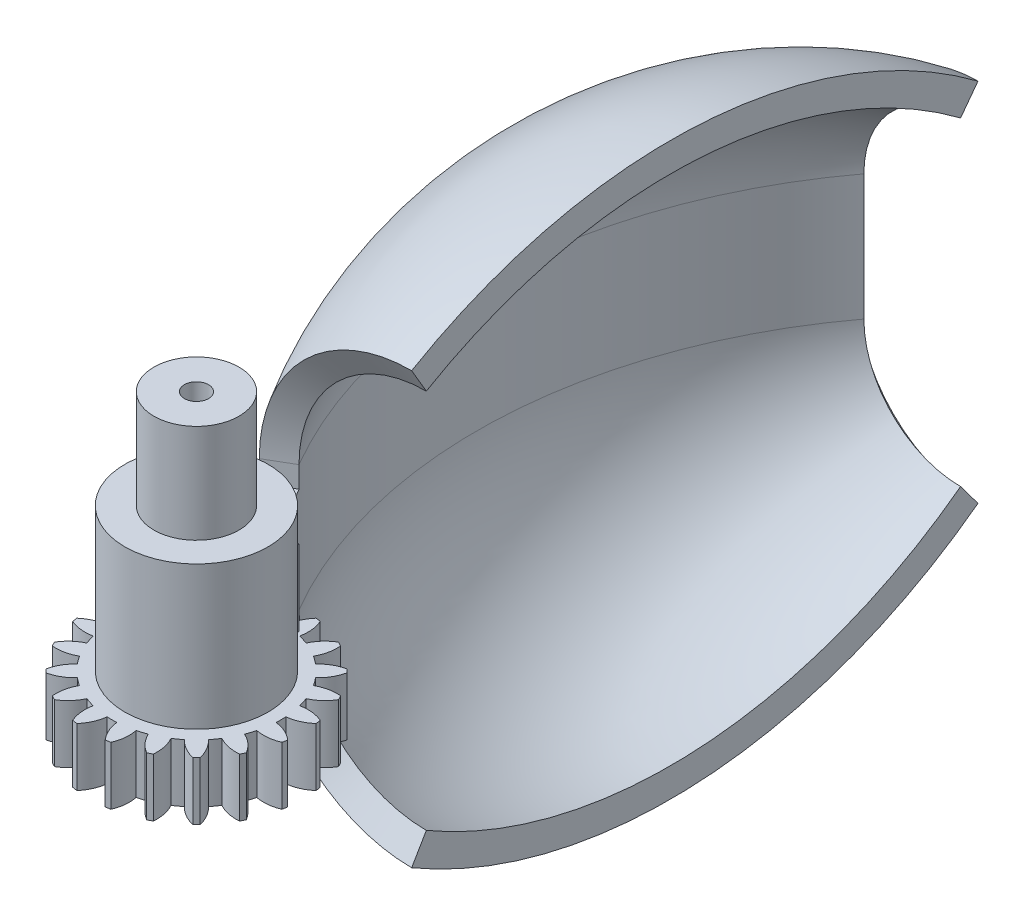
from build123d import *

# Parameters (mm, degrees)
SKETCH_1_R          = 1.25
EXTRUDE_2_DEPTH     = 3
EXTRUDE_6_DEPTH     = 10
REVOLVE_5_ANGLE     = 90
SKETCH_5_R          = 7.4
SKETCH_5_R_2        = 1.25
EXTRUDE_3_DEPTH     = 14.8
SKETCH_6_R          = 4.4
SKETCH_6_R_2        = 1.25
EXTRUDE_4_DEPTH     = 10.2
REVOLVE_6_ANGLE     = 90
EXTRUDE_7_DEPTH     = 7.8
CUT_EXTRUDE_1_DEPTH = 3
EXTRUDE_START       = 3
EXTRUDE_9_DEPTH     = 3
EXTRUDE_10_DEPTH    = 3


with BuildPart() as part:
    # 草图1 → 凸台-拉伸2 (new body)
    with BuildSketch(Plane(origin=(0, 0, 0), x_dir=(1, 0, 0), z_dir=(0, 1, 0))):
        with BuildLine():
            Line((-2.4, 31.8), (0, 30))
            ThreePointArc((0, 30), (-9.986161593, 1.176286204), (-1.366875999, -28.085255385))
            ThreePointArc((-1.366875999, -28.085255385), (0.001505949, -29.44044019), (1.780593172, -30.177897759))
            ThreePointArc((1.780593172, -30.177897759), (2.675299798, -47.593181657), (-6.473683781, -32.747686964))
            ThreePointArc((-6.473683781, -32.747686964), (-5.105814689, -29.870106713), (-5.753780394, -26.750543539))
            ThreePointArc((-5.753780394, -26.750543539), (-12.913266641, 3.030876667), (-2.4, 31.8))
        make_face()
        with Locations(Location((0, -39, 0), (0, 0, 270))):
            Circle(SKETCH_1_R, mode=Mode.SUBTRACT)
    extrude(amount=EXTRUDE_2_DEPTH)

    # 草图2 → 凸台-拉伸6 (add)
    with BuildSketch(Plane(origin=(0, 3, 0), x_dir=(1, 0, 0), z_dir=(0, 1, 0))):
        with BuildLine():
            Line((-5.753780394, -26.750543539), (-3.163943768, -25.236361829))
            ThreePointArc((-3.163943768, -25.236361829), (-9.918176076, 2.85931761), (0, 30))
            Line((0, 30), (-2.4, 31.8))
            ThreePointArc((-2.4, 31.8), (-12.913266641, 3.030876667), (-5.753780394, -26.750543539))
        make_face()
    extrude(amount=EXTRUDE_6_DEPTH)

    # 草图3 → 旋转5 (revolve)
    with BuildSketch(Plane.XZ):
        with BuildLine():
            Line((0, -30), (-2.4, -31.8))
            ThreePointArc((-2.4, -31.8), (-12.913266641, -3.030876667), (-5.753780394, 26.750543539))
            Line((-5.753780394, 26.750543539), (-3.163943768, 25.236361829))
            ThreePointArc((-3.163943768, 25.236361829), (-9.918176076, -2.85931761), (0, -30))
        make_face()
    revolve(axis=Axis((10, 0, 8.965056224), (0, 0, 1)), revolution_arc=REVOLVE_5_ANGLE)

    # 草图5 → 凸台-拉伸3 (add)
    with BuildSketch(Plane(origin=(0, 3, 0), x_dir=(1, 0, 0), z_dir=(0, 1, 0))):
        with Locations(Location((0, -39, 0), (0, 0, 270))):
            Circle(SKETCH_5_R)
        with Locations(Location((0, -39, 0), (0, 0, 270))):
            Circle(SKETCH_5_R_2, mode=Mode.SUBTRACT)
    extrude(amount=EXTRUDE_3_DEPTH)

    # 草图6 → 凸台-拉伸4 (add)
    with BuildSketch(Plane(origin=(0, 17.8, 0), x_dir=(1, 0, 0), z_dir=(0, 1, 0))):
        with Locations(Location((0, -39, 0), (0, 0, 270))):
            Circle(SKETCH_6_R)
        with Locations(Location((0, -39, 0), (0, 0, 270))):
            Circle(SKETCH_6_R_2, mode=Mode.SUBTRACT)
    extrude(amount=EXTRUDE_4_DEPTH)

    # 草图8 → 旋转6 (revolve)
    with BuildSketch(Plane(origin=(0, 13, 0), x_dir=(1, 0, 0), z_dir=(0, 1, 0))):
        with BuildLine():
            Line((0, 30), (-2.4, 31.8))
            ThreePointArc((-2.4, 31.8), (-12.913266641, 3.030876667), (-5.753780394, -26.750543539))
            Line((-5.753780394, -26.750543539), (-3.163943768, -25.236361829))
            ThreePointArc((-3.163943768, -25.236361829), (-9.918176076, 2.85931761), (0, 30))
        make_face()
    revolve(axis=Axis((10, 13, 0), (0, 0, -1)), revolution_arc=REVOLVE_6_ANGLE)

    # 草图9 → 凸台-拉伸7 (add)
    with BuildSketch(Plane(origin=(0, 3, 0), x_dir=(1, 0, 0), z_dir=(0, 1, 0))):
        with BuildLine():
            Line((-5.33393747, -33.870759212), (-6.473683781, -32.747686964))
            ThreePointArc((-6.473683781, -32.747686964), (-5.105814689, -29.870106713), (-5.753780394, -26.750543539))
            Line((-5.753780394, -26.750543539), (-3.163943768, -25.236361829))
            ThreePointArc((-3.163943768, -25.236361829), (-2.289406726, -26.675945695), (-1.366875999, -28.085255385))
            ThreePointArc((-1.366875999, -28.085255385), (0.001505949, -29.44044019), (1.780593172, -30.177897759))
            Line((1.780593172, -30.177897759), (1.470312727, -31.747539694))
            ThreePointArc((1.470312727, -31.747539694), (-2.204294517, -31.935929949), (-5.33393747, -33.870759212))
        make_face()
    extrude(amount=EXTRUDE_7_DEPTH)

    # 草图12 → 切除-拉伸1 (cut)
    with BuildSketch(Plane.XZ):
        with BuildLine():
            Line((-6.473683781, 32.747686964), (0, 39))
            Line((0, 39), (1.780593172, 30.177897759))
            ThreePointArc((1.780593172, 30.177897759), (2.675299798, 47.593181657), (-6.473683781, 32.747686964))
        make_face()
    extrude(amount=-CUT_EXTRUDE_1_DEPTH, mode=Mode.SUBTRACT)

    # 草图14 → 凸台-拉伸9 (add)
    with BuildSketch(Plane.XZ.offset(EXTRUDE_START)):
        with BuildLine():
            Line((-6.473683781, 32.747686964), (1.780593172, 30.177897759))
            ThreePointArc((1.780593172, 30.177897759), (0.001505949, 29.44044019), (-1.366875999, 28.085255385))
            ThreePointArc((-1.366875999, 28.085255385), (-2.289406726, 26.675945695), (-3.163943768, 25.236361829))
            Line((-3.163943768, 25.236361829), (-5.753780394, 26.750543539))
            ThreePointArc((-5.753780394, 26.750543539), (-5.105814689, 29.870106713), (-6.473683781, 32.747686964))
        make_face()
    extrude(amount=-EXTRUDE_9_DEPTH)

    # 草图13 → 凸台-拉伸10 (add, symmetric)
    with BuildSketch(Plane.XZ):
        with BuildLine():
            ThreePointArc((1.464956435, 49.902013697), (0.818060825, 48.891552344), (0.499924007, 47.734705318))
            ThreePointArc((0.499924007, 47.734705318), (0, 47.749), (-0.499924007, 47.734705318))
            ThreePointArc((-0.499924007, 47.734705318), (-0.818060825, 48.891552344), (-1.464956435, 49.902013697))
            ThreePointArc((-1.464956435, 49.902013697), (-1.720779115, 49.864571747), (-1.975651141, 49.821127601))
            ThreePointArc((-1.975651141, 49.821127601), (-2.278635697, 48.66022001), (-2.223716399, 47.461683425))
            ThreePointArc((-2.223716399, 47.461683425), (-2.703589684, 47.320793461), (-3.174628369, 47.152713396))
            ThreePointArc((-3.174628369, 47.152713396), (-3.834679853, 48.154630615), (-4.762163869, 48.915734733))
            ThreePointArc((-4.762163869, 48.915734733), (-4.993895497, 48.801071766), (-5.222868219, 48.680994141))
            ThreePointArc((-5.222868219, 48.680994141), (-5.15228348, 47.483278035), (-4.729683951, 46.360373002))
            ThreePointArc((-4.729683951, 46.360373002), (-5.142533172, 46.078089684), (-5.538577987, 45.772677084))
            ThreePointArc((-5.538577987, 45.772677084), (-6.4759337, 46.521589858), (-7.593217523, 46.958834566))
            ThreePointArc((-7.593217523, 46.958834566), (-7.778174593, 46.778174593), (-7.958834566, 46.593217523))
            ThreePointArc((-7.958834566, 46.593217523), (-7.521589858, 45.4759337), (-6.772677084, 44.538577987))
            ThreePointArc((-6.772677084, 44.538577987), (-7.078089684, 44.142533172), (-7.360373002, 43.729683951))
            ThreePointArc((-7.360373002, 43.729683951), (-8.483278035, 44.15228348), (-9.680994141, 44.222868219))
            ThreePointArc((-9.680994141, 44.222868219), (-9.801071766, 43.993895497), (-9.915734733, 43.762163869))
            ThreePointArc((-9.915734733, 43.762163869), (-9.154630615, 42.834679853), (-8.152713396, 42.174628369))
            ThreePointArc((-8.152713396, 42.174628369), (-8.320793461, 41.703589684), (-8.461683425, 41.223716399))
            ThreePointArc((-8.461683425, 41.223716399), (-9.66022001, 41.278635697), (-10.821127601, 40.975651141))
            ThreePointArc((-10.821127601, 40.975651141), (-10.864571747, 40.720779115), (-10.902013697, 40.464956435))
            ThreePointArc((-10.902013697, 40.464956435), (-9.891552344, 39.818060825), (-8.734705318, 39.499924007))
            ThreePointArc((-8.734705318, 39.499924007), (-8.749, 39), (-8.734705318, 38.500075993))
            ThreePointArc((-8.734705318, 38.500075993), (-9.891552344, 38.181939175), (-10.902013697, 37.535043565))
            ThreePointArc((-10.902013697, 37.535043565), (-10.864571747, 37.279220885), (-10.821127601, 37.024348859))
            ThreePointArc((-10.821127601, 37.024348859), (-9.66022001, 36.721364303), (-8.461683425, 36.776283601))
            ThreePointArc((-8.461683425, 36.776283601), (-8.320793461, 36.296410316), (-8.152713396, 35.825371631))
            ThreePointArc((-8.152713396, 35.825371631), (-9.154630615, 35.165320147), (-9.915734733, 34.237836131))
            ThreePointArc((-9.915734733, 34.237836131), (-9.801071766, 34.006104503), (-9.680994141, 33.777131781))
            ThreePointArc((-9.680994141, 33.777131781), (-8.483278035, 33.84771652), (-7.360373002, 34.270316049))
            ThreePointArc((-7.360373002, 34.270316049), (-7.078089684, 33.857466828), (-6.772677084, 33.461422013))
            ThreePointArc((-6.772677084, 33.461422013), (-7.521589858, 32.5240663), (-7.958834566, 31.406782477))
            ThreePointArc((-7.958834566, 31.406782477), (-7.778174593, 31.221825407), (-7.593217523, 31.041165434))
            ThreePointArc((-7.593217523, 31.041165434), (-6.4759337, 31.478410142), (-5.538577987, 32.227322916))
            ThreePointArc((-5.538577987, 32.227322916), (-5.142533172, 31.921910316), (-4.729683951, 31.639626998))
            ThreePointArc((-4.729683951, 31.639626998), (-5.15228348, 30.516721965), (-5.222868219, 29.319005859))
            ThreePointArc((-5.222868219, 29.319005859), (-4.993895497, 29.198928234), (-4.762163869, 29.084265267))
            ThreePointArc((-4.762163869, 29.084265267), (-3.834679853, 29.845369385), (-3.174628369, 30.847286604))
            ThreePointArc((-3.174628369, 30.847286604), (-2.703589684, 30.679206539), (-2.223716399, 30.538316575))
            ThreePointArc((-2.223716399, 30.538316575), (-2.278635697, 29.33977999), (-1.975651141, 28.178872399))
            ThreePointArc((-1.975651141, 28.178872399), (-1.720779115, 28.135428253), (-1.464956435, 28.097986303))
            ThreePointArc((-1.464956435, 28.097986303), (-0.818060825, 29.108447656), (-0.499924007, 30.265294682))
            ThreePointArc((-0.499924007, 30.265294682), (0, 30.251), (0.499924007, 30.265294682))
            ThreePointArc((0.499924007, 30.265294682), (0.818060825, 29.108447656), (1.464956435, 28.097986303))
            ThreePointArc((1.464956435, 28.097986303), (1.720779115, 28.135428253), (1.975651141, 28.178872399))
            ThreePointArc((1.975651141, 28.178872399), (2.278635697, 29.33977999), (2.223716399, 30.538316575))
            ThreePointArc((2.223716399, 30.538316575), (2.703589684, 30.679206539), (3.174628369, 30.847286604))
            ThreePointArc((3.174628369, 30.847286604), (3.834679853, 29.845369385), (4.762163869, 29.084265267))
            ThreePointArc((4.762163869, 29.084265267), (4.993895497, 29.198928234), (5.222868219, 29.319005859))
            ThreePointArc((5.222868219, 29.319005859), (5.15228348, 30.516721965), (4.729683951, 31.639626998))
            ThreePointArc((4.729683951, 31.639626998), (5.142533172, 31.921910316), (5.538577987, 32.227322916))
            ThreePointArc((5.538577987, 32.227322916), (6.4759337, 31.478410142), (7.593217523, 31.041165434))
            ThreePointArc((7.593217523, 31.041165434), (7.778174593, 31.221825407), (7.958834566, 31.406782477))
            ThreePointArc((7.958834566, 31.406782477), (7.521589858, 32.5240663), (6.772677084, 33.461422013))
            ThreePointArc((6.772677084, 33.461422013), (7.078089684, 33.857466828), (7.360373002, 34.270316049))
            ThreePointArc((7.360373002, 34.270316049), (8.483278035, 33.84771652), (9.680994141, 33.777131781))
            ThreePointArc((9.680994141, 33.777131781), (9.801071766, 34.006104503), (9.915734733, 34.237836131))
            ThreePointArc((9.915734733, 34.237836131), (9.154630615, 35.165320147), (8.152713396, 35.825371631))
            ThreePointArc((8.152713396, 35.825371631), (8.320793461, 36.296410316), (8.461683425, 36.776283601))
            ThreePointArc((8.461683425, 36.776283601), (9.66022001, 36.721364303), (10.821127601, 37.024348859))
            ThreePointArc((10.821127601, 37.024348859), (10.864571747, 37.279220885), (10.902013697, 37.535043565))
            ThreePointArc((10.902013697, 37.535043565), (9.891552344, 38.181939175), (8.734705318, 38.500075993))
            ThreePointArc((8.734705318, 38.500075993), (8.749, 39), (8.734705318, 39.499924007))
            ThreePointArc((8.734705318, 39.499924007), (9.891552344, 39.818060825), (10.902013697, 40.464956435))
            ThreePointArc((10.902013697, 40.464956435), (10.864571747, 40.720779115), (10.821127601, 40.975651141))
            ThreePointArc((10.821127601, 40.975651141), (9.66022001, 41.278635697), (8.461683425, 41.223716399))
            ThreePointArc((8.461683425, 41.223716399), (8.320793461, 41.703589684), (8.152713396, 42.174628369))
            ThreePointArc((8.152713396, 42.174628369), (9.154630615, 42.834679853), (9.915734733, 43.762163869))
            ThreePointArc((9.915734733, 43.762163869), (9.801071766, 43.993895497), (9.680994141, 44.222868219))
            ThreePointArc((9.680994141, 44.222868219), (8.483278035, 44.15228348), (7.360373002, 43.729683951))
            ThreePointArc((7.360373002, 43.729683951), (7.078089684, 44.142533172), (6.772677084, 44.538577987))
            ThreePointArc((6.772677084, 44.538577987), (7.521589858, 45.4759337), (7.958834566, 46.593217523))
            ThreePointArc((7.958834566, 46.593217523), (7.778174593, 46.778174593), (7.593217523, 46.958834566))
            ThreePointArc((7.593217523, 46.958834566), (6.4759337, 46.521589858), (5.538577987, 45.772677084))
            ThreePointArc((5.538577987, 45.772677084), (5.142533172, 46.078089684), (4.729683951, 46.360373002))
            ThreePointArc((4.729683951, 46.360373002), (5.15228348, 47.483278035), (5.222868219, 48.680994141))
            ThreePointArc((5.222868219, 48.680994141), (4.993895497, 48.801071766), (4.762163869, 48.915734733))
            ThreePointArc((4.762163869, 48.915734733), (3.834679853, 48.154630615), (3.174628369, 47.152713396))
            ThreePointArc((3.174628369, 47.152713396), (2.703589684, 47.320793461), (2.223716399, 47.461683425))
            ThreePointArc((2.223716399, 47.461683425), (2.278635697, 48.66022001), (1.975651141, 49.821127601))
            ThreePointArc((1.975651141, 49.821127601), (1.720779115, 49.864571747), (1.464956435, 49.902013697))
        make_face()
    extrude(amount=EXTRUDE_10_DEPTH, both=True)


solid = part.part
